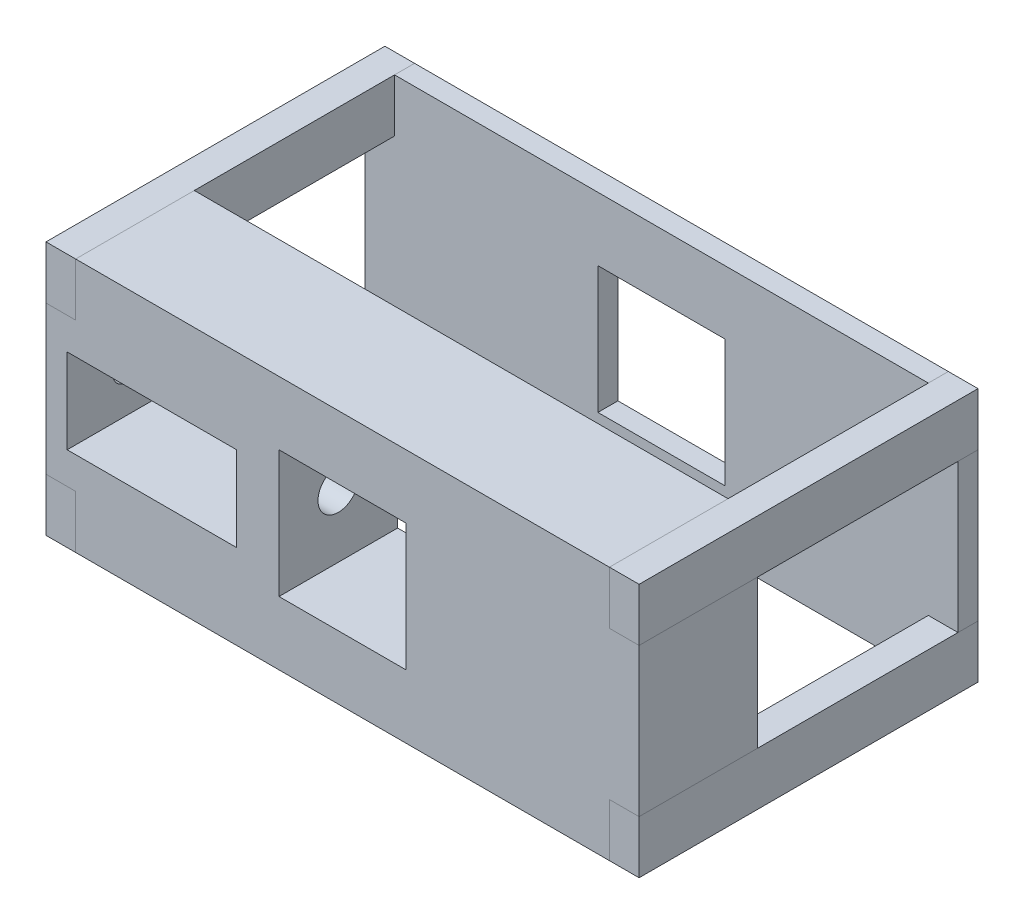
from build123d import *

# Parameters (mm, degrees)
SKETCH1_W                = 88.9
SKETCH1_H                = 38.1
BOSS_EXTRUDE1_DEPTH      = 17.78
SKETCH2_W                = 4.445
SKETCH2_H                = 8.89
SKETCH2_W_2              = 19.05
SKETCH2_H_2              = 19.05
SKETCH2_W_3              = 25.4
SKETCH2_H_3              = 12.7
CUT_EXTRUDE1_DEPTH       = 20.32
SKETCH3_W                = 19.05
SKETCH3_H                = 19.05
BOSS_EXTRUDE2_DEPTH      = 3
SKETCH6_R                = 2.032
SPRINGPLUNGER_HOLE_DEPTH = 4.445
SKETCH8_W                = 4.445
SKETCH8_H                = 7.9375
SUPPORT_DEPTH            = 50.8
SUPPORT_2_DEPTH          = 50.8
SUPPORT_3_DEPTH          = 50.8
SUPPORT_4_DEPTH          = 50.8
SKETCH9_R                = 3.048
CUT_EXTRUDE4_DEPTH       = 6.35


with BuildPart() as part:
    # Sketch1 → Boss-Extrude1 (new body)
    with BuildSketch(Plane.XY):
        with Locations((44.45, 19.05)):
            Rectangle(SKETCH1_W, SKETCH1_H)
    extrude(amount=-BOSS_EXTRUDE1_DEPTH)

    # Sketch2 → Cut-Extrude1 (cut)
    with BuildSketch(Plane.XY):
        with Locations((86.6775, 34.6075)):
            Rectangle(SKETCH2_W, SKETCH2_H)
        with Locations((44.45, 19.05)):
            Rectangle(SKETCH2_W_2, SKETCH2_H_2)
        with Locations((2.2225, 34.6075)):
            Rectangle(SKETCH2_W, SKETCH2_H)
        with Locations((86.6775, 3.4925)):
            Rectangle(SKETCH2_W, SKETCH2_H)
        with Locations((2.2225, 3.4925)):
            Rectangle(SKETCH2_W, SKETCH2_H)
        with Locations((15.875, 19.05)):
            Rectangle(SKETCH2_W_3, SKETCH2_H_3)
    extrude(amount=-CUT_EXTRUDE1_DEPTH, mode=Mode.SUBTRACT)

    # Sketch6 → SpringPlunger Hole (cut)
    with BuildSketch(Plane.ZY.offset(-4.445)):
        with Locations(Location((-8.89, 19.05, 0), (0, 0, 270))):
            Circle(SKETCH6_R)
    extrude(amount=SPRINGPLUNGER_HOLE_DEPTH, mode=Mode.SUBTRACT)

    # Sketch9 → Cut-Extrude4 (cut)
    with BuildSketch(Plane.ZY.offset(-28.575)):
        with Locations(Location((-8.89, 19.05, 0), (0, 0, 270))):
            Circle(SKETCH9_R)
    extrude(amount=-CUT_EXTRUDE4_DEPTH, mode=Mode.SUBTRACT)


with BuildPart() as body_2:
    # Sketch3 → Boss-Extrude2 (new body)
    with BuildSketch(Plane.XY.offset(-50.8)):
        Polygon((88.9, 30.1625), (84.455, 30.1625), (84.455, 38.1), (4.445, 38.1), (4.445, 30.1625), (0, 30.1625), (0, 7.9375), (4.445, 7.9375), (4.445, 0), (84.455, 0), (84.455, 7.9375), (88.9, 7.9375), align=None)
        with Locations((44.45, 19.05)):
            Rectangle(SKETCH3_W, SKETCH3_H, mode=Mode.SUBTRACT)
    extrude(amount=BOSS_EXTRUDE2_DEPTH)


with BuildPart() as body_3:
    # Sketch8 → Support (new body)
    with BuildSketch(Plane.XY):
        with Locations((2.2225, 34.13125)):
            Rectangle(SKETCH8_W, SKETCH8_H)
    extrude(amount=-SUPPORT_DEPTH)


with BuildPart() as body_4:
    # Sketch8 → Support 2 (new body)
    with BuildSketch(Plane.XY):
        with Locations((86.6775, 34.13125)):
            Rectangle(SKETCH8_W, SKETCH8_H)
    extrude(amount=-SUPPORT_2_DEPTH)


with BuildPart() as body_5:
    # Sketch8 → Support 3 (new body)
    with BuildSketch(Plane.XY):
        with Locations((86.6775, 3.96875)):
            Rectangle(SKETCH8_W, SKETCH8_H)
    extrude(amount=-SUPPORT_3_DEPTH)


with BuildPart() as body_6:
    # Sketch8 → Support 4 (new body)
    with BuildSketch(Plane.XY):
        with Locations((2.2225, 3.96875)):
            Rectangle(SKETCH8_W, SKETCH8_H)
    extrude(amount=-SUPPORT_4_DEPTH)


solid = Compound([part.part, body_2.part, body_3.part, body_4.part, body_5.part, body_6.part])
